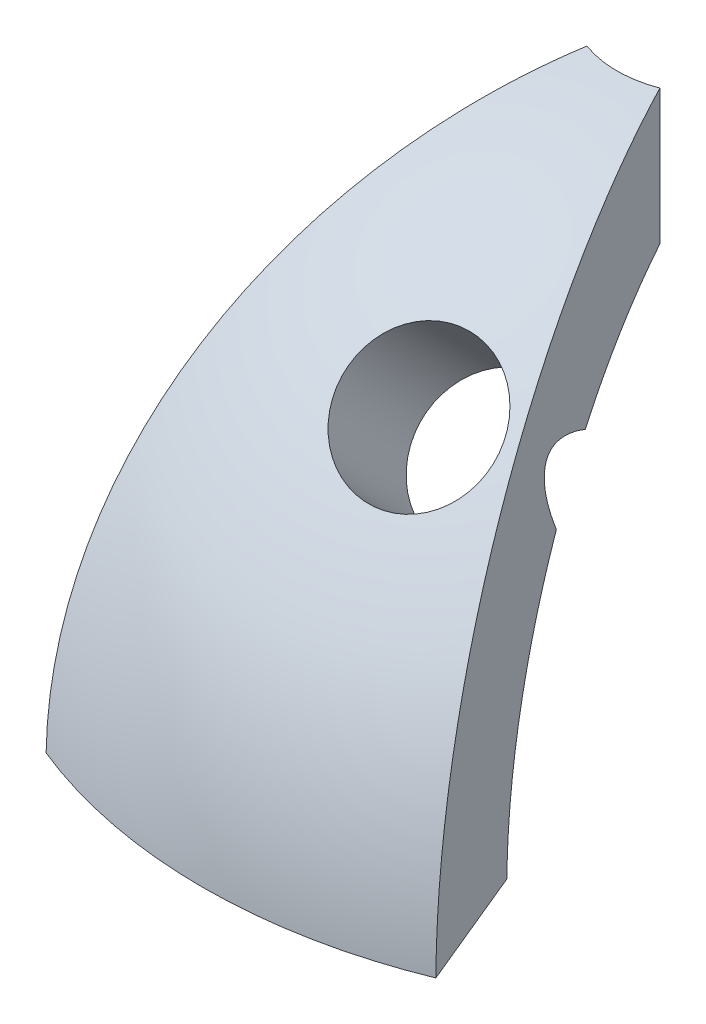
from build123d import *

# Parameters (mm, degrees)
REVOLVE1_ANGLE            = 45
CUT_EXTRUDE1_DEPTH        = 28.647117169
CUT_EXTRUDE1_DEPTH_BACK   = 28.647117169
CUT_EXTRUDE4_REACH        = 29.998
CUT_EXTRUDE4_START_RADIUS = 14.22
CUT_EXTRUDE4_END_RADIUS   = 14.22
CUT_EXTRUDE5_DEPTH        = 26.992100662
CUT_EXTRUDE5_DEPTH_BACK   = 26.992100662
SKETCH9_R                 = 2.6035


with BuildPart() as part:
    # Sketch1 → Revolve1 (revolve, symmetric)
    with BuildSketch(Plane(origin=(0, 0, 0), x_dir=(0, 0, -1), z_dir=(1, 0, 0))) as revolve1_sk:
        with BuildLine():
            Line((-14.217802221, 0.25), (-19.048359509, 0.25))
            ThreePointArc((-19.048359509, 0.25), (-14.676690222, 12.144845166), (-3.81, 18.66511184))
            Line((-3.81, 18.66511184), (-3.81, 13.700083941))
            ThreePointArc((-3.81, 13.700083941), (-11.246181696, 8.70240181), (-14.217802221, 0.25))
        make_face()
    revolve(axis=Axis((0, 0, 0), (0, 1, 0)), revolution_arc=REVOLVE1_ANGLE / 2)
    revolve(revolve1_sk.sketch, axis=Axis((0, 0, 0), (0, -1, 0)), revolution_arc=REVOLVE1_ANGLE / 2)

    # Sketch2 → Cut-Extrude1 (cut, two sides: drawn at the far end of the back side and taken through both)
    with BuildSketch(Plane(origin=(0, 0, 0), x_dir=(1, 0, 0), z_dir=(0, 1, 0)).offset(-CUT_EXTRUDE1_DEPTH_BACK)):
        with BuildLine():
            Line((7.289491598, -17.598389479), (1.458023877, -3.519981019))
            ThreePointArc((1.458023877, -3.519981019), (1.400077392, -3.543428184), (1.341754023, -3.5659215))
            Line((1.341754023, -3.5659215), (7.173849701, -17.645845983))
            ThreePointArc((7.173849701, -17.645845983), (7.231709577, -17.622212591), (7.289491598, -17.598389479))
        make_face()
        with BuildLine():
            Line((-7.173849701, -17.645845983), (-1.341754023, -3.5659215))
            ThreePointArc((-1.341754023, -3.5659215), (-1.400077392, -3.543428184), (-1.458023877, -3.519981019))
            Line((-1.458023877, -3.519981019), (-7.289491598, -17.598389479))
            ThreePointArc((-7.289491598, -17.598389479), (-7.231709577, -17.622212591), (-7.173849701, -17.645845983))
        make_face()
    extrude(amount=CUT_EXTRUDE1_DEPTH + CUT_EXTRUDE1_DEPTH_BACK, mode=Mode.SUBTRACT)

    # Cut-Extrude4: from a sphere face, 29.998 long prism both ways, kept between that surface and its translate by the depth
    cut_extrude4_start = Location((0, 0, 0)) * Sphere(CUT_EXTRUDE4_START_RADIUS, mode=Mode.PRIVATE)
    cut_extrude4_end = Location((0, 0.145802388, 0.351998102)) * Sphere(CUT_EXTRUDE4_END_RADIUS, mode=Mode.PRIVATE)
    # Sketch8 → Cut-Extrude4 (cut, from a surface)
    with BuildSketch(Plane(origin=(0, 0, 0), x_dir=(-1, 0, 0), z_dir=(0, 0.3826834323650899, 0.9238795325112868)), mode=Mode.PRIVATE) as cut_extrude4_sk1:
        Polygon((0.887753405, -0.619026887), (0.968782051, -0.619026887), (0.968782051, 2.458280805), (1.481666667, 2.458280805), (1.481666667, 2.914178241), (0.968782051, 2.914178241), (0.968782051, 3.939947472), (0.569871795, 3.939947472), (0.569871795, 2.914178241), (-1.538653846, 2.914178241), align=None)
        Polygon((0.569871795, 2.458280805), (0.569871795, 0.5278401), (-0.755080128, 2.458280805), align=None, mode=Mode.SUBTRACT)
    cut_extrude4_tool1 = extrude(cut_extrude4_sk1.sketch, amount=CUT_EXTRUDE4_REACH, both=True, mode=Mode.PRIVATE)
    add(((cut_extrude4_tool1 - cut_extrude4_start) & cut_extrude4_end).solids().sort_by_distance((-0.928268, 5.918875, 12.814738))[0], mode=Mode.SUBTRACT)

    # Sketch9 → Cut-Extrude5 (cut, two sides: drawn at the far end of the back side and taken through both)
    with BuildSketch(Plane(origin=(2.950125281, 18.858537854, 18.626357959), x_dir=(-0.8917235779063104, -0.23968096505674769, 0.3839037582460406), z_dir=(-0.1106158710412275, -0.7071067811865475, -0.6984011233337121)).offset(-CUT_EXTRUDE5_DEPTH_BACK)):
        with Locations(Location((0, 0, 0), (0, 0, 116.203724747))):
            Circle(SKETCH9_R)
    extrude(amount=CUT_EXTRUDE5_DEPTH + CUT_EXTRUDE5_DEPTH_BACK, mode=Mode.SUBTRACT)


solid = part.part
